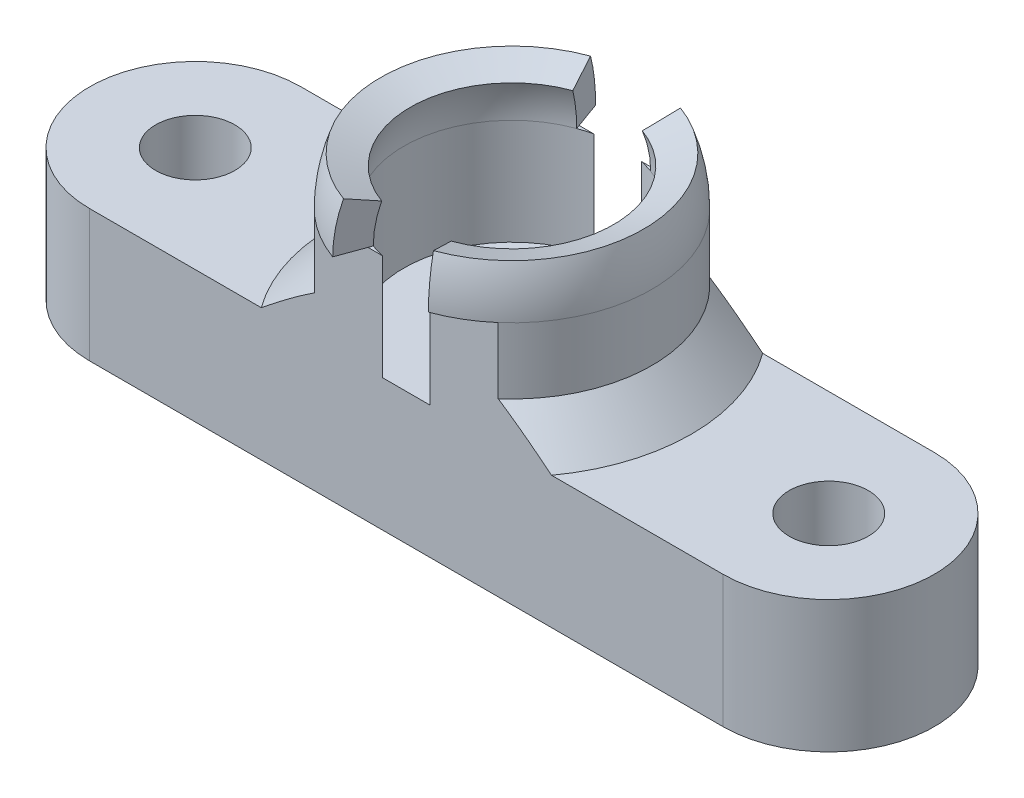
from build123d import *

# Parameters (mm, degrees)
CROQUIS1_R                  = 1.5
SALIENTE_EXTRUIR1_DEPTH     = 5
SALIENTE_EXTRUIR2_DEPTH     = 4
REVOLUCI_N1_ANGLE           = 70
REVOLUCI_N1_OTHER_WAY_ANGLE = 70
REVOLUCI_N2_ANGLE           = 70
REVOLUCI_N2_OTHER_WAY_ANGLE = 70
CHAFL_N1_SIZE               = 1.5


with BuildPart() as part:
    # Croquis1 → Saliente-Extruir1 (new body)
    with BuildSketch(Plane(origin=(0, 0, 0), x_dir=(1, 0, 0), z_dir=(0, 1, 0))):
        with BuildLine():
            Line((-12, 4), (12, 4))
            ThreePointArc((12, 4), (16, 0), (12, -4))
            Line((12, -4), (-12, -4))
            ThreePointArc((-12, -4), (-16, 0), (-12, 4))
        make_face()
        with Locations(Location((12, 0, 0), (0, 0, 270))):
            Circle(CROQUIS1_R, mode=Mode.SUBTRACT)
        with Locations(Location((-12, 0, 0), (0, 0, 270))):
            Circle(CROQUIS1_R, mode=Mode.SUBTRACT)
    extrude(amount=SALIENTE_EXTRUIR1_DEPTH)

    # Croquis2 → Saliente-Extruir2 (add)
    with BuildSketch(Plane(origin=(0, 5, 0), x_dir=(1, 0, 0), z_dir=(0, 1, 0))):
        with BuildLine():
            Line((-3.47706773, -4), (-0.9, -4))
            ThreePointArc((-0.9, -4), (-4.1, 0), (-0.9, 4))
            Line((-0.9, 4), (-3.47706773, 4))
            ThreePointArc((-3.47706773, 4), (-5.3, 0), (-3.47706773, -4))
        make_face()
        with BuildLine():
            Line((0.9, -4), (3.47706773, -4))
            ThreePointArc((3.47706773, -4), (5.3, 0), (3.47706773, 4))
            Line((3.47706773, 4), (0.9, 4))
            ThreePointArc((0.9, 4), (4.1, 0), (0.9, -4))
        make_face()
    extrude(amount=SALIENTE_EXTRUIR2_DEPTH)

    # Croquis4 → Revolución1 (revolve)
    with BuildSketch(Plane.XY):
        with BuildLine():
            Line((4.1, 9), (5.3, 9))
            ThreePointArc((5.3, 9), (5.219481091, 9.920335342), (4.98037089, 10.81270676))
            Line((4.98037089, 10.81270676), (3.852739745, 10.402282588))
            ThreePointArc((3.852739745, 10.402282588), (4.037711787, 9.711957528), (4.1, 9))
        make_face()
    revolve(axis=Axis((0, 9, 0), (0, 1, 0)), revolution_arc=REVOLUCI_N1_ANGLE)

    # Croquis4 → Revolución1 other way (revolve)
    with BuildSketch(Plane.XY):
        with BuildLine():
            Line((4.1, 9), (5.3, 9))
            ThreePointArc((5.3, 9), (5.219481091, 9.920335342), (4.98037089, 10.81270676))
            Line((4.98037089, 10.81270676), (3.852739745, 10.402282588))
            ThreePointArc((3.852739745, 10.402282588), (4.037711787, 9.711957528), (4.1, 9))
        make_face()
    revolve(axis=Axis((0, 9, 0), (0, -1, 0)), revolution_arc=REVOLUCI_N1_OTHER_WAY_ANGLE)

    # Croquis5 → Revolución2 (revolve)
    with BuildSketch(Plane.XY):
        with BuildLine():
            Line((-5.3, 9), (-4.1, 9))
            ThreePointArc((-4.1, 9), (-4.037711787, 9.711957528), (-3.852739745, 10.402282588))
            Line((-3.852739745, 10.402282588), (-4.98037089, 10.81270676))
            ThreePointArc((-4.98037089, 10.81270676), (-5.219481091, 9.920335342), (-5.3, 9))
        make_face()
    revolve(axis=Axis((0, 9, 0), (0, 1, 0)), revolution_arc=REVOLUCI_N2_ANGLE)

    # Croquis5 → Revolución2 other way (revolve)
    with BuildSketch(Plane.XY):
        with BuildLine():
            Line((-5.3, 9), (-4.1, 9))
            ThreePointArc((-4.1, 9), (-4.037711787, 9.711957528), (-3.852739745, 10.402282588))
            Line((-3.852739745, 10.402282588), (-4.98037089, 10.81270676))
            ThreePointArc((-4.98037089, 10.81270676), (-5.219481091, 9.920335342), (-5.3, 9))
        make_face()
    revolve(axis=Axis((0, 9, 0), (0, -1, 0)), revolution_arc=REVOLUCI_N2_OTHER_WAY_ANGLE)

    # Chaflán1
    chafl_n1_edges = [part.edges().sort_by_distance(p)[0] for p in [
        (-5.3, 5, 0),
        (5.3, 5, 0),
    ]]
    chamfer(chafl_n1_edges, length=CHAFL_N1_SIZE)


solid = part.part
